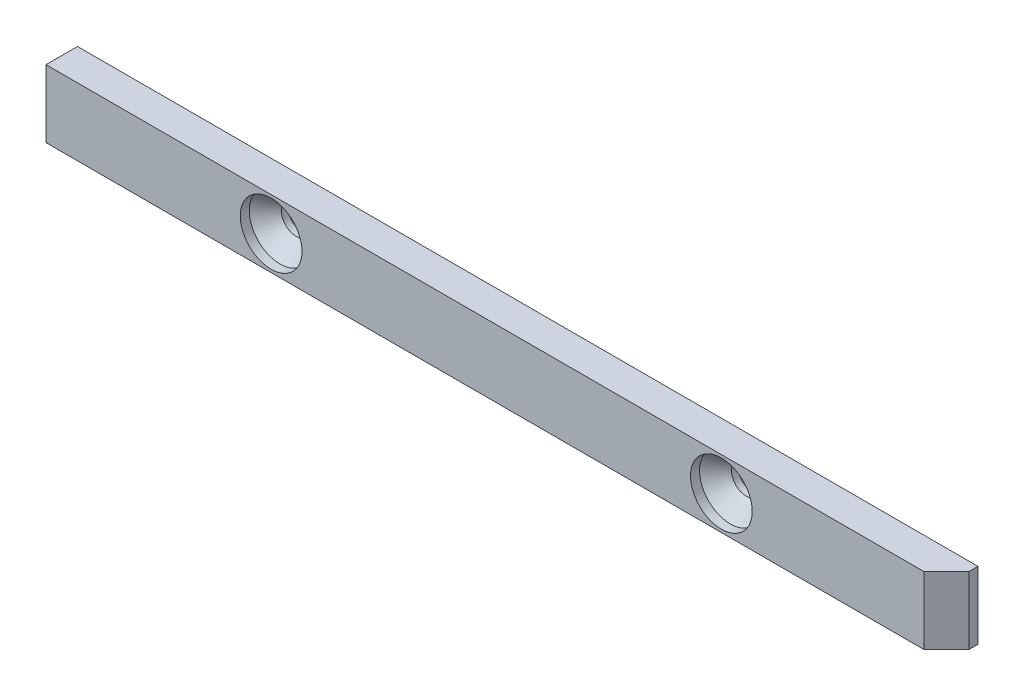
from build123d import *

# Parameters (mm, degrees)
SKETCH_1_W                 = 200
SKETCH_1_H                 = 15
EXTRUDE_1_DEPTH            = 7
CHAMFER_1_SIZE             = 5
HOLE_WIZARD_M61_AT_2_COUNT = 2
HOLE_WIZARD_M61_AT_2_PITCH = 100


with BuildPart() as part:
    # Эскиз1 → Бобышка-Вытянуть1 (new body)
    with BuildSketch(Plane.XY):
        Rectangle(SKETCH_1_W, SKETCH_1_H)
    extrude(amount=EXTRUDE_1_DEPTH)

    # Фаска1
    chamfer_1_edges = [part.edges().sort_by_distance(p)[0] for p in [
        (100, 0, 7),
    ]]
    chamfer(chamfer_1_edges, length=CHAMFER_1_SIZE)

    # Эскиз4 → Зенковка для винта с потайной головкой и внутренним шестигранником M61 (revolve, cut)
    with BuildSketch(Plane(origin=(-50, 0, 7), x_dir=(0, -1, 0), z_dir=(1, 0, 0))):
        Polygon((0, 0), (0, 31.982840043), (3.3, 30), (3.3, 5.555), (6.855, 2), (6.855, 0), align=None)
    hole_wizard_m61 = revolve(axis=Axis((-50, 0, 13.35), (0, 0, -1)), mode=Mode.SUBTRACT)

    # Зенковка для винта с потайной головкой и внутренним шестигранником M61 at 2: Зенковка для винта с потайной головкой и внутренним шестигранником M61 ×2
    with Locations(*[(i * HOLE_WIZARD_M61_AT_2_PITCH, 0, 0) for i in range(1, HOLE_WIZARD_M61_AT_2_COUNT)]):
        add(hole_wizard_m61, mode=Mode.SUBTRACT)


solid = part.part
